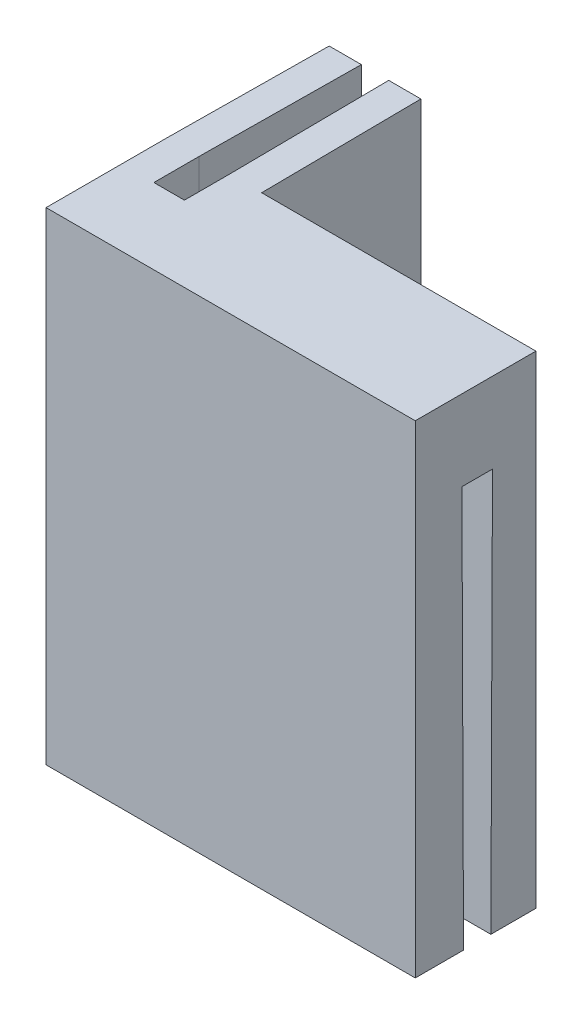
from build123d import *

# Parameters (mm, degrees)
BOSS_EXTRUDE1_DEPTH     = 38.1
SKETCH2_3_W             = 12.7
SKETCH2_3_H             = 9.525
SKETCH2_3_W_2           = 8.9535
ARM_RIGHT_DEPTH         = 38.1
CUT_EXTRUDE1_DEPTH      = 48.518879101
CUT_EXTRUDE1_DEPTH_BACK = 48.518879101


with BuildPart() as part:
    # Sketch2 → Boss-Extrude1 (new body)
    with BuildSketch(Plane(origin=(0, 0, 0), x_dir=(1, 0, 0), z_dir=(0, 1, 0))):
        Polygon((-3.6195, 12.699364984), (-3.7465, 0), (-3.7465, -9.525), (3.7465, -9.525), (3.7465, 0), (3.6195, 12.699364984), (1.0795, 12.699364984), (1.2065, 0), (1.2065, -3.556), (-1.2065, -3.556), (-1.2065, 0), (-1.0795, 12.699364984), align=None)
    extrude(amount=BOSS_EXTRUDE1_DEPTH)

    # Sketch2<3> → Arm Right (add)
    with BuildSketch(Plane(origin=(0, 0, 0), x_dir=(1, 0, 0), z_dir=(0, 1, 0))):
        with Locations((19.05, -4.7625)):
            Rectangle(SKETCH2_3_W, SKETCH2_3_H)
        with Locations((8.22325, -4.7625)):
            Rectangle(SKETCH2_3_W_2, SKETCH2_3_H)
    extrude(amount=ARM_RIGHT_DEPTH)

    # Sketch3 → Cut-Extrude1 (cut, two sides: drawn at the far end of the back side and taken through both)
    with BuildSketch(Plane(origin=(0, 0, 0), x_dir=(0, 0, -1), z_dir=(1, 0, 0)).offset(-CUT_EXTRUDE1_DEPTH_BACK)):
        Polygon((-5.715, 0), (-3.556, 0), (-3.429, 31.75), (-5.842, 31.75), align=None)
    extrude(amount=CUT_EXTRUDE1_DEPTH + CUT_EXTRUDE1_DEPTH_BACK, mode=Mode.SUBTRACT)


solid = part.part
